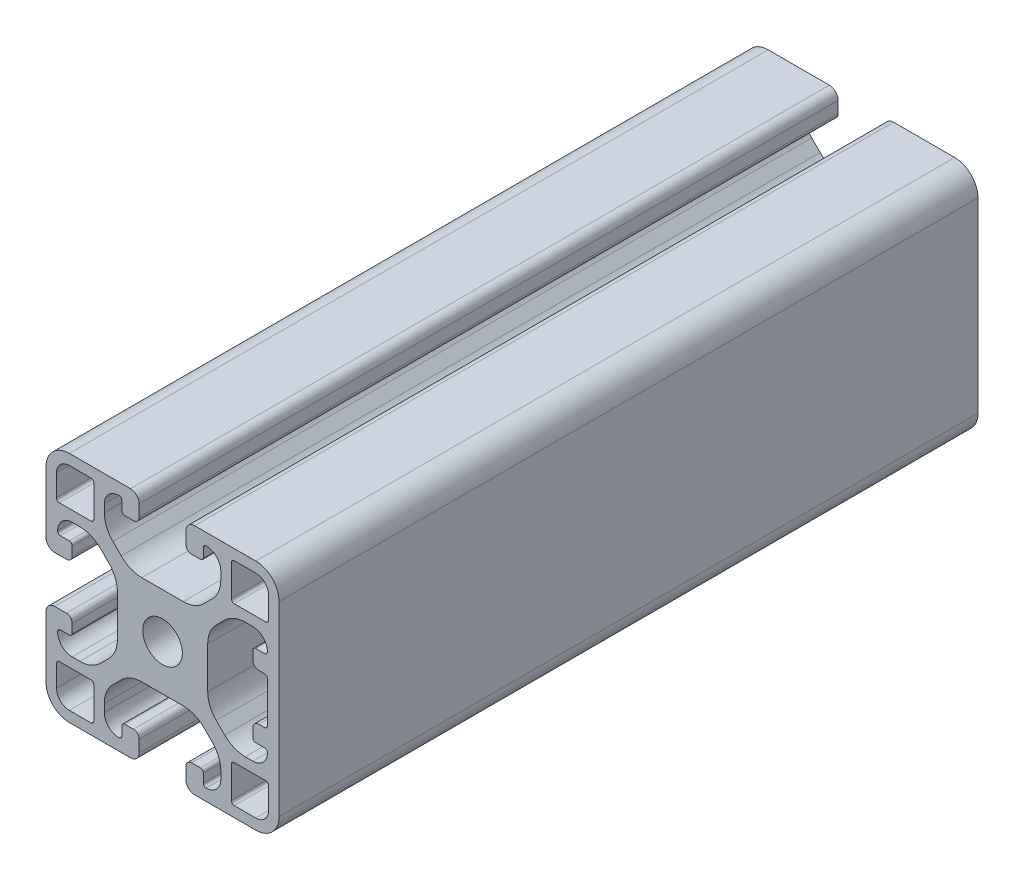
from build123d import *

# Parameters (mm, degrees)
SCHIZZO1_R                   = 3.4
ESTRUSIONE_ESTRUSIONE1_DEPTH = 119.94


with BuildPart() as part:
    # Schizzo1 → Estrusione-Estrusione1 (new body)
    with BuildSketch(Plane(origin=(0, 0, -340), x_dir=(-1, 0, 0), z_dir=(0, 0, -1))):
        with BuildLine():
            Line((6.5, -15.5), (5, -15.5))
            ThreePointArc((5, -15.5), (4.292893219, -15.792893219), (4, -16.5))
            Line((4, -16.5), (4, -18.5))
            ThreePointArc((4, -18.5), (4.439339828, -19.560660172), (5.5, -20))
            Line((5.5, -20), (16, -20))
            ThreePointArc((16, -20), (18.828427125, -18.828427125), (20, -16))
            Line((20, -16), (20, -5.5))
            ThreePointArc((20, -5.5), (19.560660172, -4.439339828), (18.5, -4))
            Line((18.5, -4), (16.5, -4))
            ThreePointArc((16.5, -4), (15.792893219, -4.292893219), (15.5, -5))
            Line((15.5, -5), (15.5, -6.5))
            ThreePointArc((15.5, -6.5), (15.646446609, -6.853553391), (16, -7))
            Line((16, -7), (17.55, -7))
            ThreePointArc((17.55, -7), (17.868198052, -7.131801948), (18, -7.45))
            Line((18, -7.45), (18, -7.5))
            ThreePointArc((18, -7.5), (17.267766953, -9.267766953), (15.5, -10))
            Line((15.5, -10), (14.192388155, -10))
            ThreePointArc((14.192388155, -10), (12.278970994, -9.619397663), (10.656854249, -8.535533906))
            Line((10.656854249, -8.535533906), (9.214466094, -7.09314575))
            ThreePointArc((9.214466094, -7.09314575), (8.130602337, -5.471029006), (7.75, -3.557611845))
            Line((7.75, -3.557611845), (7.75, 3.557611845))
            ThreePointArc((7.75, 3.557611845), (8.130602337, 5.471029006), (9.214466094, 7.09314575))
            Line((9.214466094, 7.09314575), (10.656854249, 8.535533906))
            ThreePointArc((10.656854249, 8.535533906), (12.278970994, 9.619397663), (14.192388155, 10))
            Line((14.192388155, 10), (15.5, 10))
            ThreePointArc((15.5, 10), (17.267766953, 9.267766953), (18, 7.5))
            Line((18, 7.5), (18, 7.45))
            ThreePointArc((18, 7.45), (17.868198052, 7.131801948), (17.55, 7))
            Line((17.55, 7), (16, 7))
            ThreePointArc((16, 7), (15.646446609, 6.853553391), (15.5, 6.5))
            Line((15.5, 6.5), (15.5, 5))
            ThreePointArc((15.5, 5), (15.792893219, 4.292893219), (16.5, 4))
            Line((16.5, 4), (18.5, 4))
            ThreePointArc((18.5, 4), (19.560660172, 4.439339828), (20, 5.5))
            Line((20, 5.5), (20, 16))
            ThreePointArc((20, 16), (18.828427125, 18.828427125), (16, 20))
            Line((16, 20), (5.5, 20))
            ThreePointArc((5.5, 20), (4.439339828, 19.560660172), (4, 18.5))
            Line((4, 18.5), (4, 16.5))
            ThreePointArc((4, 16.5), (4.292893219, 15.792893219), (5, 15.5))
            Line((5, 15.5), (6.5, 15.5))
            ThreePointArc((6.5, 15.5), (6.853553391, 15.646446609), (7, 16))
            Line((7, 16), (7, 17.55))
            ThreePointArc((7, 17.55), (7.131801948, 17.868198052), (7.45, 18))
            Line((7.45, 18), (7.5, 18))
            ThreePointArc((7.5, 18), (9.267766953, 17.267766953), (10, 15.5))
            Line((10, 15.5), (10, 14.192388155))
            ThreePointArc((10, 14.192388155), (9.619397663, 12.278970994), (8.535533906, 10.656854249))
            Line((8.535533906, 10.656854249), (7.09314575, 9.214466094))
            ThreePointArc((7.09314575, 9.214466094), (5.471029006, 8.130602337), (3.557611844, 7.75))
            Line((3.557611844, 7.75), (-3.557611845, 7.75))
            ThreePointArc((-3.557611845, 7.75), (-5.471029006, 8.130602337), (-7.09314575, 9.214466094))
            Line((-7.09314575, 9.214466094), (-8.535533906, 10.656854249))
            ThreePointArc((-8.535533906, 10.656854249), (-9.619397663, 12.278970994), (-10, 14.192388155))
            Line((-10, 14.192388155), (-10, 15.5))
            ThreePointArc((-10, 15.5), (-9.267766953, 17.267766953), (-7.5, 18))
            Line((-7.5, 18), (-7.45, 18))
            ThreePointArc((-7.45, 18), (-7.131801948, 17.868198052), (-7, 17.55))
            Line((-7, 17.55), (-7, 16))
            ThreePointArc((-7, 16), (-6.853553391, 15.646446609), (-6.5, 15.5))
            Line((-6.5, 15.5), (-5, 15.5))
            ThreePointArc((-5, 15.5), (-4.292893219, 15.792893219), (-4, 16.5))
            Line((-4, 16.5), (-4, 18.5))
            ThreePointArc((-4, 18.5), (-4.439339828, 19.560660172), (-5.5, 20))
            Line((-5.5, 20), (-16, 20))
            ThreePointArc((-16, 20), (-18.828427125, 18.828427125), (-20, 16))
            Line((-20, 16), (-20, -16))
            ThreePointArc((-20, -16), (-18.828427125, -18.828427125), (-16, -20))
            Line((-16, -20), (-5.5, -20))
            ThreePointArc((-5.5, -20), (-4.439339828, -19.560660172), (-4, -18.5))
            Line((-4, -18.5), (-4, -16.5))
            ThreePointArc((-4, -16.5), (-4.292893219, -15.792893219), (-5, -15.5))
            Line((-5, -15.5), (-6.5, -15.5))
            ThreePointArc((-6.5, -15.5), (-6.853553391, -15.646446609), (-7, -16))
            Line((-7, -16), (-7, -17.55))
            ThreePointArc((-7, -17.55), (-7.131801948, -17.868198052), (-7.45, -18))
            Line((-7.45, -18), (-7.5, -18))
            ThreePointArc((-7.5, -18), (-9.267766953, -17.267766953), (-10, -15.5))
            Line((-10, -15.5), (-10, -14.192388155))
            ThreePointArc((-10, -14.192388155), (-9.619397663, -12.278970994), (-8.535533906, -10.656854249))
            Line((-8.535533906, -10.656854249), (-7.09314575, -9.214466094))
            ThreePointArc((-7.09314575, -9.214466094), (-5.471029006, -8.130602337), (-3.557611845, -7.75))
            Line((-3.557611845, -7.75), (3.557611845, -7.75))
            ThreePointArc((3.557611845, -7.75), (5.471029006, -8.130602337), (7.09314575, -9.214466094))
            Line((7.09314575, -9.214466094), (8.535533906, -10.656854249))
            ThreePointArc((8.535533906, -10.656854249), (9.619397663, -12.278970994), (10, -14.192388155))
            Line((10, -14.192388155), (10, -15.5))
            ThreePointArc((10, -15.5), (9.267766953, -17.267766953), (7.5, -18))
            Line((7.5, -18), (7.45, -18))
            ThreePointArc((7.45, -18), (7.131801948, -17.868198052), (7, -17.55))
            Line((7, -17.55), (7, -16))
            ThreePointArc((7, -16), (6.853553391, -15.646446609), (6.5, -15.5))
        make_face()
        with Locations(Location((0, 0, 0), (0, 0, 180))):
            Circle(SCHIZZO1_R, mode=Mode.SUBTRACT)
        with BuildLine():
            Line((-12.3, -18.2), (-16, -18.2))
            ThreePointArc((-16, -18.2), (-17.555634919, -17.555634919), (-18.2, -16))
            Line((-18.2, -16), (-18.2, -12.3))
            ThreePointArc((-18.2, -12.3), (-18.053553391, -11.946446609), (-17.7, -11.8))
            Line((-17.7, -11.8), (-12.3, -11.8))
            ThreePointArc((-12.3, -11.8), (-11.946446609, -11.946446609), (-11.8, -12.3))
            Line((-11.8, -12.3), (-11.8, -17.7))
            ThreePointArc((-11.8, -17.7), (-11.946446609, -18.053553391), (-12.3, -18.2))
        make_face(mode=Mode.SUBTRACT)
        with BuildLine():
            Line((-11.8, 17.7), (-11.8, 12.3))
            ThreePointArc((-11.8, 12.3), (-11.946446609, 11.946446609), (-12.3, 11.8))
            Line((-12.3, 11.8), (-17.7, 11.8))
            ThreePointArc((-17.7, 11.8), (-18.053553391, 11.946446609), (-18.2, 12.3))
            Line((-18.2, 12.3), (-18.2, 16))
            ThreePointArc((-18.2, 16), (-17.555634919, 17.555634919), (-16, 18.2))
            Line((-16, 18.2), (-12.3, 18.2))
            ThreePointArc((-12.3, 18.2), (-11.946446609, 18.053553391), (-11.8, 17.7))
        make_face(mode=Mode.SUBTRACT)
        with BuildLine():
            Line((18.2, 16), (18.2, 12.3))
            ThreePointArc((18.2, 12.3), (18.053553391, 11.946446609), (17.7, 11.8))
            Line((17.7, 11.8), (12.3, 11.8))
            ThreePointArc((12.3, 11.8), (11.946446609, 11.946446609), (11.8, 12.3))
            Line((11.8, 12.3), (11.8, 17.7))
            ThreePointArc((11.8, 17.7), (11.946446609, 18.053553391), (12.3, 18.2))
            Line((12.3, 18.2), (16, 18.2))
            ThreePointArc((16, 18.2), (17.555634919, 17.555634919), (18.2, 16))
        make_face(mode=Mode.SUBTRACT)
        with BuildLine():
            Line((18.2, -12.3), (18.2, -16))
            ThreePointArc((18.2, -16), (17.555634919, -17.555634919), (16, -18.2))
            Line((16, -18.2), (12.3, -18.2))
            ThreePointArc((12.3, -18.2), (11.946446609, -18.053553391), (11.8, -17.7))
            Line((11.8, -17.7), (11.8, -12.3))
            ThreePointArc((11.8, -12.3), (11.946446609, -11.946446609), (12.3, -11.8))
            Line((12.3, -11.8), (17.7, -11.8))
            ThreePointArc((17.7, -11.8), (18.053553391, -11.946446609), (18.2, -12.3))
        make_face(mode=Mode.SUBTRACT)
        with BuildLine():
            Line((-16, 7), (-17.5, 7))
            ThreePointArc((-17.5, 7), (-17.853553391, 7.146446609), (-18, 7.5))
            ThreePointArc((-18, 7.5), (-17.267766953, 9.267766953), (-15.5, 10))
            Line((-15.5, 10), (-14.192388155, 10))
            ThreePointArc((-14.192388155, 10), (-12.278970994, 9.619397663), (-10.656854249, 8.535533906))
            Line((-10.656854249, 8.535533906), (-9.214466094, 7.093145751))
            ThreePointArc((-9.214466094, 7.093145751), (-8.130602337, 5.471029006), (-7.75, 3.557611845))
            Line((-7.75, 3.557611845), (-7.75, -3.557611845))
            ThreePointArc((-7.75, -3.557611845), (-8.130602337, -5.471029006), (-9.214466094, -7.093145751))
            Line((-9.214466094, -7.093145751), (-10.656854249, -8.535533906))
            ThreePointArc((-10.656854249, -8.535533906), (-12.278970994, -9.619397663), (-14.192388155, -10))
            Line((-14.192388155, -10), (-15.5, -10))
            ThreePointArc((-15.5, -10), (-17.267766953, -9.267766953), (-18, -7.5))
            ThreePointArc((-18, -7.5), (-17.853553391, -7.146446609), (-17.5, -7))
            Line((-17.5, -7), (-16, -7))
            ThreePointArc((-16, -7), (-15.646446609, -6.853553391), (-15.5, -6.5))
            Line((-15.5, -6.5), (-15.5, -5))
            ThreePointArc((-15.5, -5), (-15.792893219, -4.292893219), (-16.5, -4))
            Line((-16.5, -4), (-17.5, -4))
            ThreePointArc((-17.5, -4), (-17.853553391, -3.853553391), (-18, -3.5))
            Line((-18, -3.5), (-18, 3.5))
            ThreePointArc((-18, 3.5), (-17.853553391, 3.853553391), (-17.5, 4))
            Line((-17.5, 4), (-16.5, 4))
            ThreePointArc((-16.5, 4), (-15.792893219, 4.292893219), (-15.5, 5))
            Line((-15.5, 5), (-15.5, 6.5))
            ThreePointArc((-15.5, 6.5), (-15.646446609, 6.853553391), (-16, 7))
        make_face(mode=Mode.SUBTRACT)
    extrude(amount=-ESTRUSIONE_ESTRUSIONE1_DEPTH)


solid = part.part
